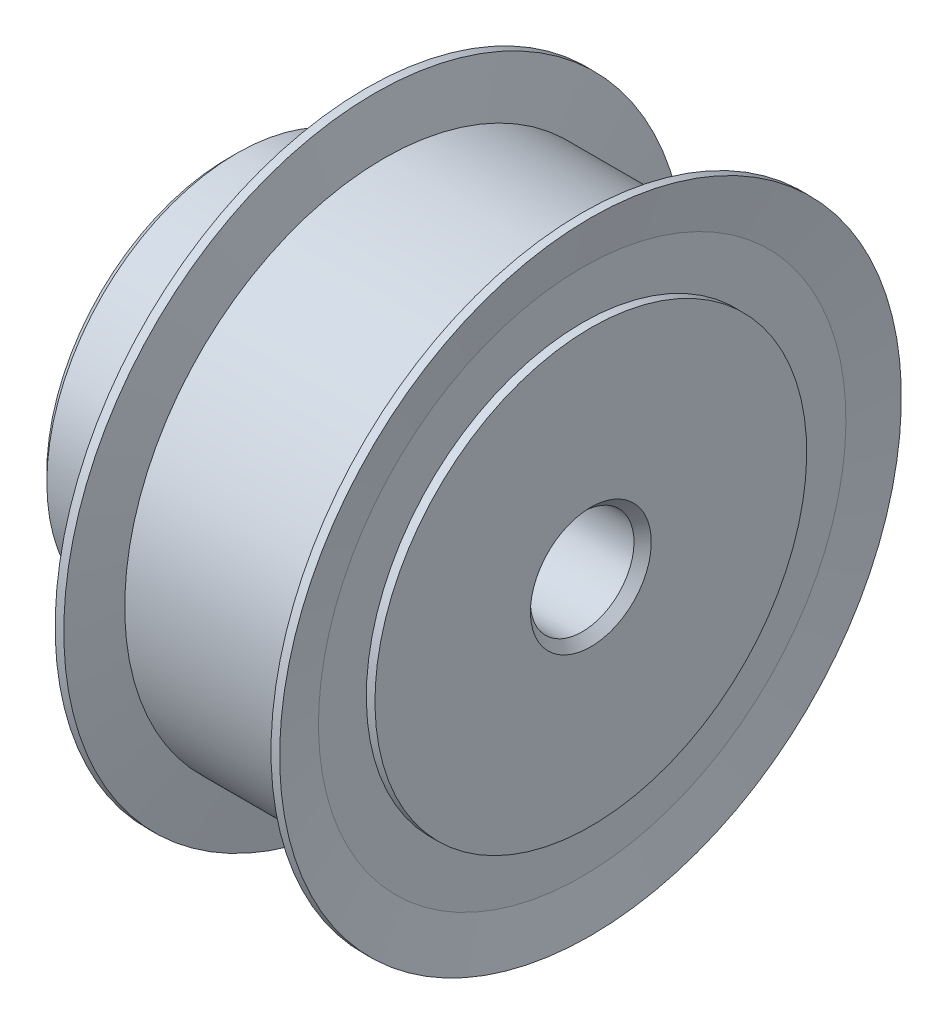
from build123d import *

# Parameters (mm, degrees)
FASE1_SIZE = 0.5


with BuildPart() as part:
    # Layout → Rotation1 (revolve)
    with BuildSketch(Plane.XY):
        Polygon((0, 3), (0, 11), (7.962375299, 11), (7.962375299, 12.5), (8.462375299, 12.5), (8.462375299, 15.271049232), (7.981187649, 18), (8.481187649, 18), (9.010168592, 15), (19.952206707, 15), (20.481187649, 18), (20.981187649, 18), (20.5, 15.271049232), (20.5, 12.5), (21, 12.5), (21, 3), align=None)
    revolve(axis=Axis((21, 0, 0), (-1, 0, 0)))

    # Fase1
    fase1_edges = [part.edges().sort_by_distance(p)[0] for p in [
        (0, -11, 0),
        (0, -3, 0),
        (21, -3, 0),
    ]]
    chamfer(fase1_edges, length=FASE1_SIZE)


solid = part.part
